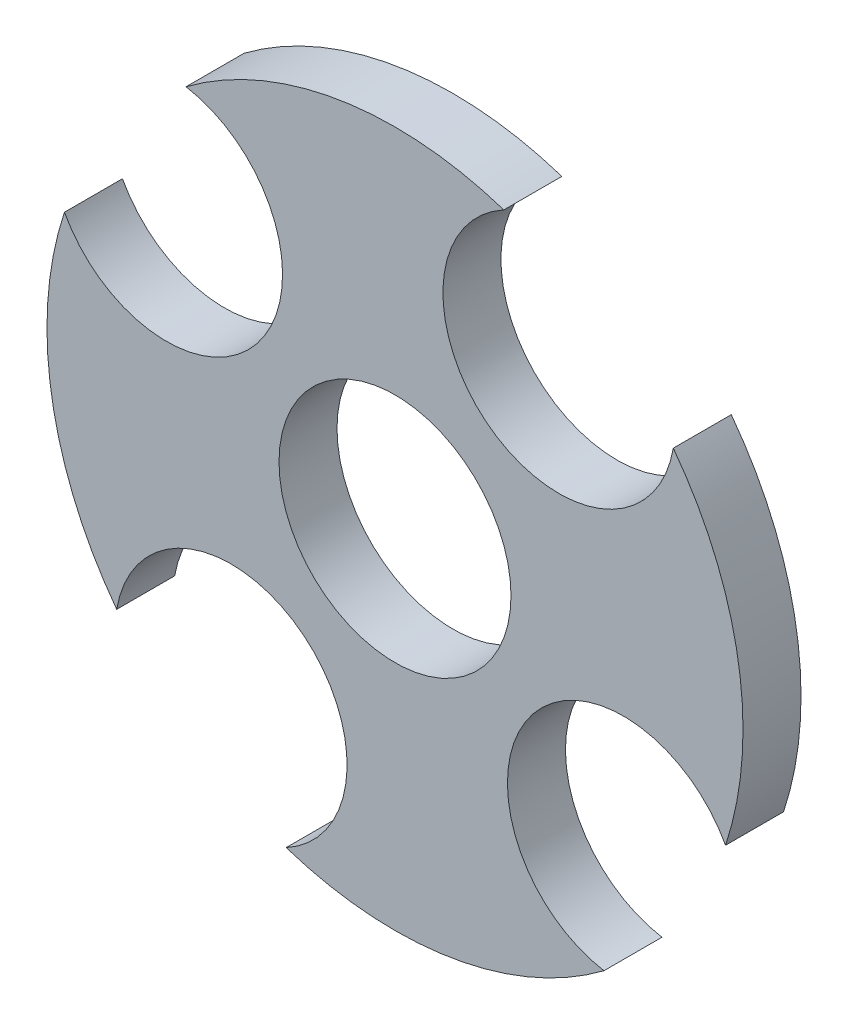
from build123d import *

# Parameters (mm, degrees)
SKETCH1_R           = 6.35
BOSS_EXTRUDE1_DEPTH = 3.175


with BuildPart() as part:
    # Sketch1 → Boss-Extrude1 (new body)
    with BuildSketch(Plane.XY):
        with BuildLine():
            ThreePointArc((-18.094184787, 5.958437454), (-18.797583349, -3.090851056), (-15.233644329, -11.438469323))
            ThreePointArc((-15.233644329, -11.438469323), (-5.271893312, -7.346753532), (-5.958437454, -18.094184787))
            ThreePointArc((-5.958437454, -18.094184787), (3.090851056, -18.797583349), (11.438469323, -15.233644329))
            ThreePointArc((11.438469323, -15.233644329), (7.346753532, -5.271893312), (18.094184787, -5.958437454))
            ThreePointArc((18.094184787, -5.958437454), (18.797583349, 3.090851056), (15.233644329, 11.438469323))
            ThreePointArc((15.233644329, 11.438469323), (5.271893312, 7.346753532), (5.958437454, 18.094184787))
            ThreePointArc((5.958437454, 18.094184787), (-3.090851056, 18.797583349), (-11.438469323, 15.233644329))
            ThreePointArc((-11.438469323, 15.233644329), (-7.346753532, 5.271893312), (-18.094184787, 5.958437454))
        make_face()
        Circle(SKETCH1_R, mode=Mode.SUBTRACT)
    extrude(amount=BOSS_EXTRUDE1_DEPTH)


solid = part.part
